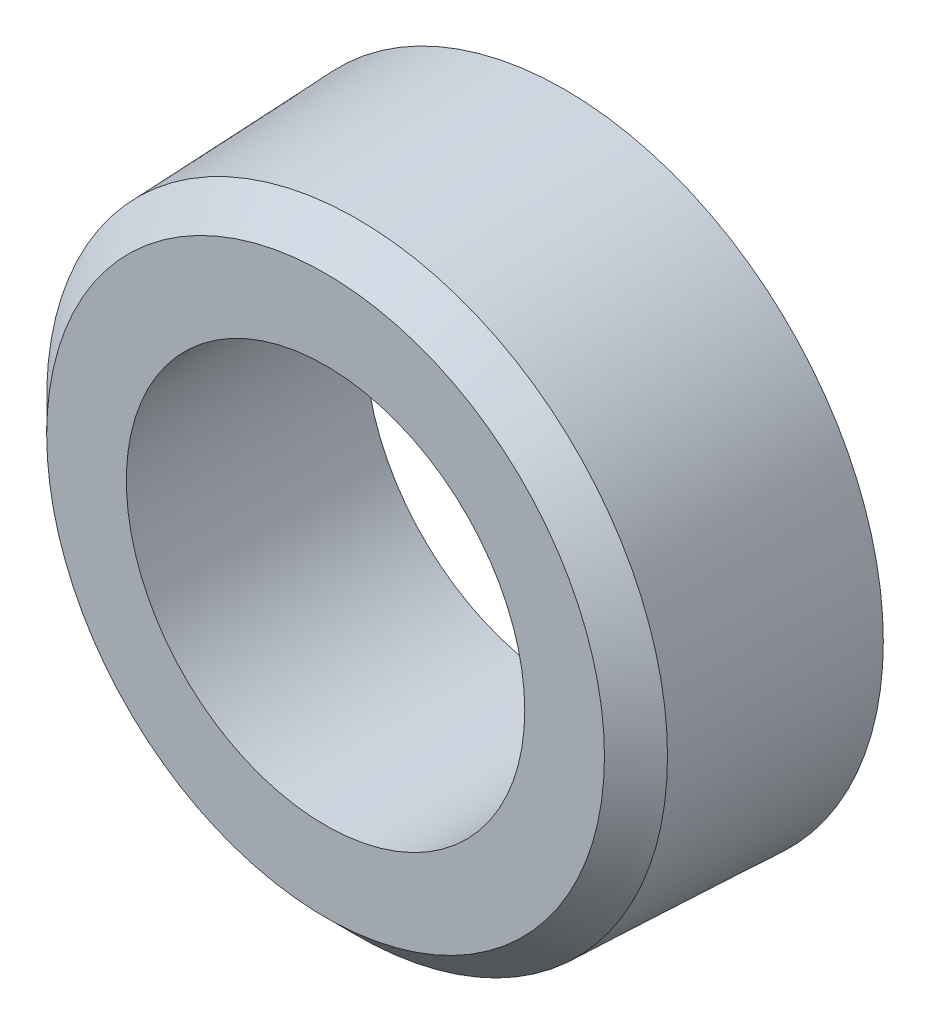
from build123d import *

# Parameters (mm, degrees)
SKETCH_1_R      = 8
SKETCH_1_R_2    = 5
EXTRUDE_1_DEPTH = 6
CHAMFER_1_SIZE  = 1


with BuildPart() as part:
    # Эскиз1 → Вытянуть1 (new body)
    with BuildSketch(Plane.XY):
        Circle(SKETCH_1_R)
        Circle(SKETCH_1_R_2, mode=Mode.SUBTRACT)
    extrude(amount=EXTRUDE_1_DEPTH)

    # Фаска1
    chamfer_1_edges = [part.edges().sort_by_distance(p)[0] for p in [
        (-8, 0, 6),
    ]]
    chamfer(chamfer_1_edges, length=CHAMFER_1_SIZE)

    # Эскиз4 → Вырез-Повернуть1 (revolve, cut)
    with BuildSketch(Plane(origin=(0, 0, 0), x_dir=(0, 0, -1), z_dir=(1, 0, 0)), mode=Mode.PRIVATE) as cut_revolve_1_sk:
        Polygon((0, 8), (-6, 7.76), (-6, 8), align=None)
    revolve(cut_revolve_1_sk.sketch.rotate(Axis((0, 0, 6), (0, 0, -1)), 90), axis=Axis((0, 0, 6), (0, 0, -1)), mode=Mode.SUBTRACT)


solid = part.part
